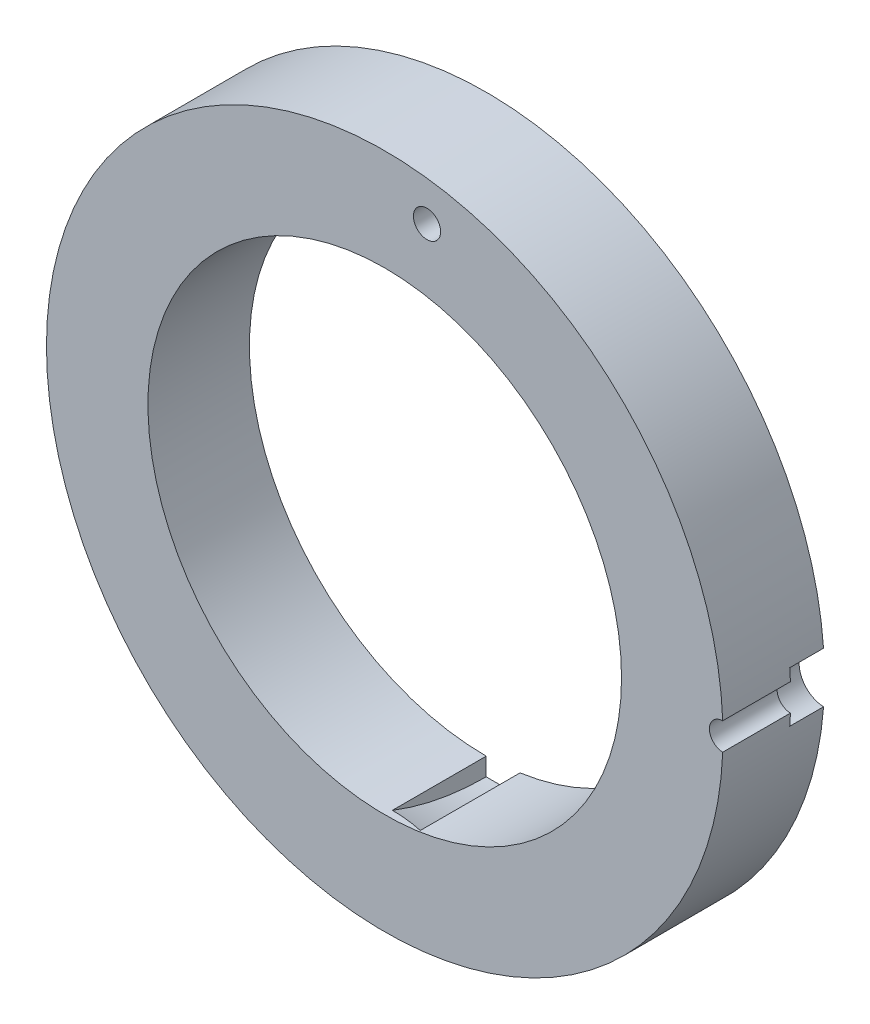
from build123d import *

# Parameters (mm, degrees)
SKETCH1_R           = 63.5
BOSS_EXTRUDE1_DEPTH = 19.05
SKETCH2_R           = 44.45
CUT_EXTRUDE1_DEPTH  = 92.800885072
SKETCH3_R           = 47.8155
CUT_EXTRUDE2_DEPTH  = 6.35
SKETCH4_R           = 2.5527
CUT_EXTRUDE3_DEPTH  = 92.800885093
SKETCH5_R           = 4.7625
CUT_EXTRUDE4_DEPTH  = 6.35


with BuildPart() as part:
    # Sketch1 → Boss-Extrude1 (new body)
    with BuildSketch(Plane.XY):
        Circle(SKETCH1_R)
    extrude(amount=BOSS_EXTRUDE1_DEPTH)

    # Sketch2 → Cut-Extrude1 (cut, through all)
    with BuildSketch(Plane.XY):
        Circle(SKETCH2_R)
    extrude(amount=CUT_EXTRUDE1_DEPTH, mode=Mode.SUBTRACT)

    # Sketch3 → Cut-Extrude2 (cut)
    with BuildSketch(Plane(origin=(0, 0, 0), x_dir=(0, 0, -1), z_dir=(1, 0, 0))):
        Circle(SKETCH3_R)
    extrude(amount=CUT_EXTRUDE2_DEPTH, mode=Mode.SUBTRACT)

    # Sketch4 → Cut-Extrude3 (cut, through all)
    with BuildSketch(Plane.XY):
        with Locations((63.5, 111.125)):
            Circle(SKETCH4_R)
        with Locations((7.9375, 55.5625)):
            Circle(SKETCH4_R)
        with Locations((63.5, 0)):
            Circle(SKETCH4_R)
        with Locations((119.0625, 55.5625)):
            Circle(SKETCH4_R)
    extrude(amount=CUT_EXTRUDE3_DEPTH, mode=Mode.SUBTRACT)

    # Sketch5 → Cut-Extrude4 (cut)
    with BuildSketch(Plane.XY):
        with Locations((63.5, 111.125)):
            Circle(SKETCH5_R)
        with Locations((7.9375, 55.5625)):
            Circle(SKETCH5_R)
        with Locations((63.5, 0)):
            Circle(SKETCH5_R)
        with Locations((119.0625, 55.5625)):
            Circle(SKETCH5_R)
    extrude(amount=CUT_EXTRUDE4_DEPTH, mode=Mode.SUBTRACT)


solid = part.part
